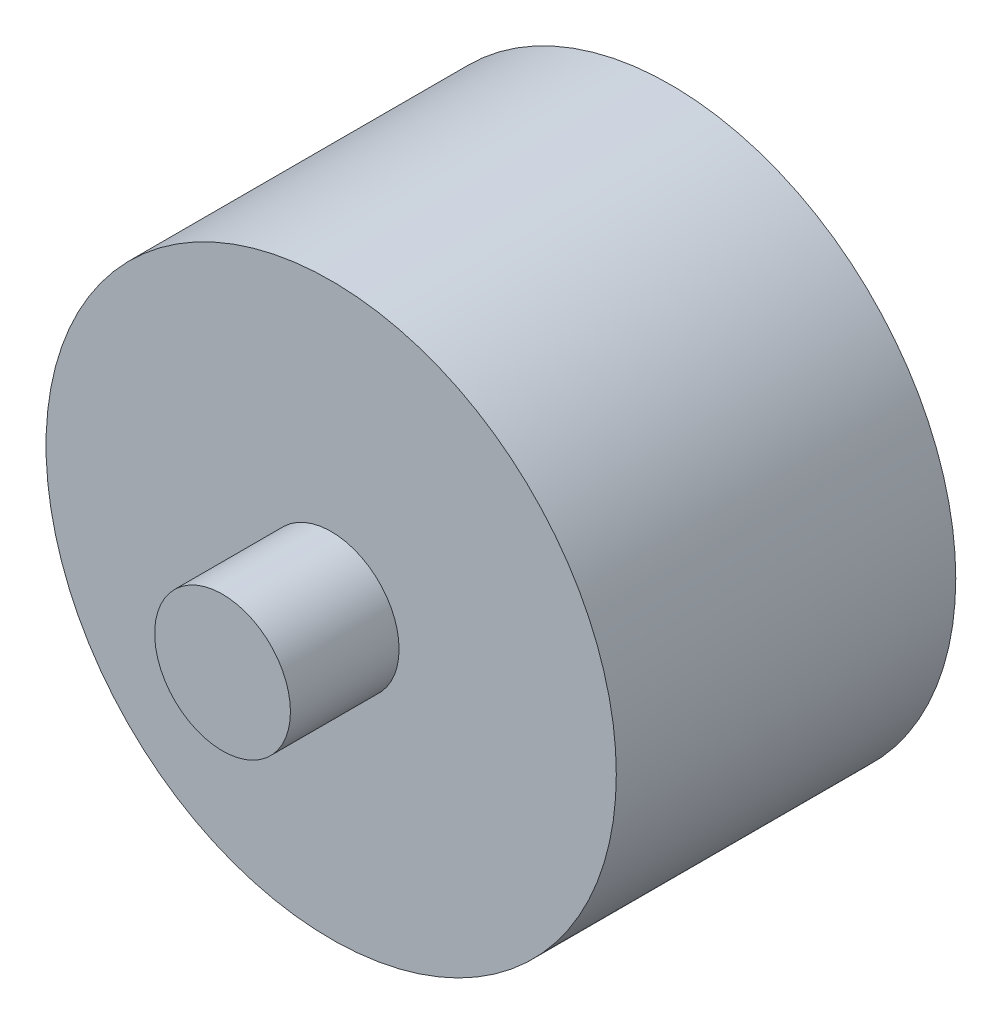
from build123d import *

# Parameters (mm, degrees)
SKETCH_1_R      = 21
SKETCH_1_R_2    = 5
EXTRUDE_1_DEPTH = 25
SKETCH_2_R      = 5
EXTRUDE_2_DEPTH = 8
SKETCH_3_R      = 5
EXTRUDE_3_DEPTH = 8


with BuildPart() as part:
    # 草图1 → 凸台-拉伸1 (new body)
    with BuildSketch(Plane.XY):
        Circle(SKETCH_1_R)
        Circle(SKETCH_1_R_2, mode=Mode.SUBTRACT)
    extrude(amount=EXTRUDE_1_DEPTH)


with BuildPart() as body_2:
    # 草图2 → 凸台-拉伸2 (new body)
    with BuildSketch(Plane.XY.offset(25)):
        Circle(SKETCH_2_R)
    extrude(amount=EXTRUDE_2_DEPTH)


with BuildPart() as body_3:
    # 草图3 → 凸台-拉伸3 (new body)
    with BuildSketch(Plane(origin=(0, 0, 0), x_dir=(-1, 0, 0), z_dir=(0, 0, -1))):
        Circle(SKETCH_3_R)
    extrude(amount=EXTRUDE_3_DEPTH)


solid = Compound([part.part, body_2.part, body_3.part])
